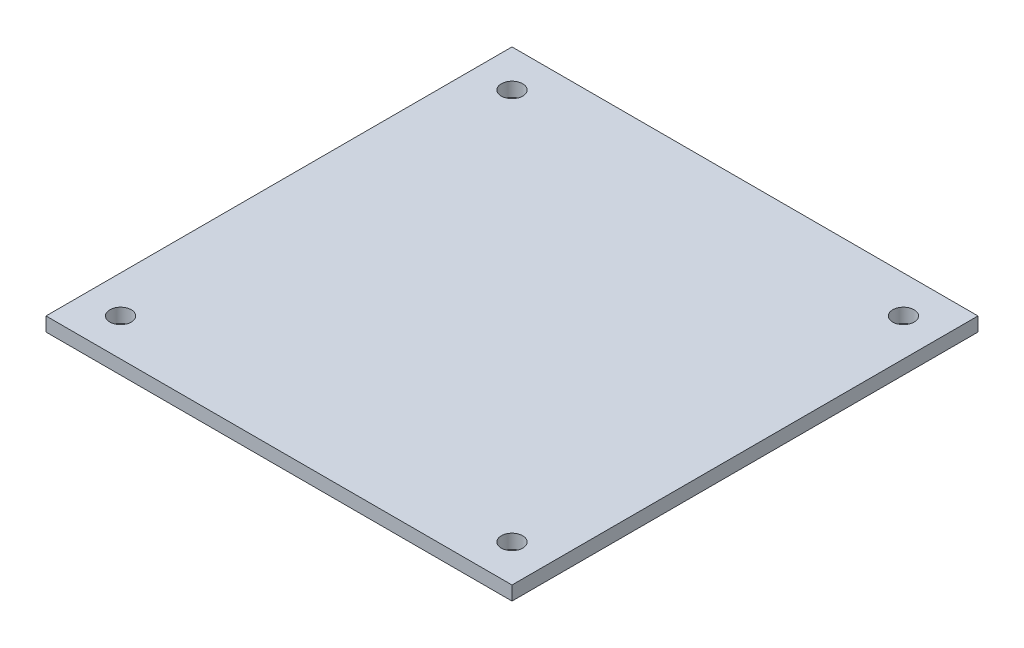
from build123d import *

# Parameters (mm, degrees)
ESQUISSE1_W             = 50
ESQUISSE1_H             = 50
BOSS_EXTRU_1_DEPTH      = 1.5
ESQUISSE2_R             = 1.15
ENL_V_MAT_EXTRU_1_DEPTH = 1.5


with BuildPart() as part:
    # Esquisse1 → Boss.-Extru.1 (new body)
    with BuildSketch(Plane(origin=(0, 0, 0), x_dir=(1, 0, 0), z_dir=(0, 1, 0))):
        with Locations((-24.890409064, 20.551542387)):
            Rectangle(ESQUISSE1_W, ESQUISSE1_H)
    extrude(amount=BOSS_EXTRU_1_DEPTH)

    # Esquisse2 → Enlèv. mat.-Extru.1 (cut)
    with BuildSketch(Plane(origin=(0, 1.5, 0), x_dir=(1, 0, 0), z_dir=(0, 1, 0))):
        with Locations(Location((-3.890409064, -0.448457613, 0), (0, 0, 270))):
            Circle(ESQUISSE2_R)
        with Locations(Location((-45.890409064, -0.448457613, 0), (0, 0, 270))):
            Circle(ESQUISSE2_R)
        with Locations(Location((-45.890409064, 41.551542387, 0), (0, 0, 270))):
            Circle(ESQUISSE2_R)
        with Locations(Location((-3.890409064, 41.551542387, 0), (0, 0, 270))):
            Circle(ESQUISSE2_R)
    extrude(amount=-ENL_V_MAT_EXTRU_1_DEPTH, mode=Mode.SUBTRACT)


solid = part.part
